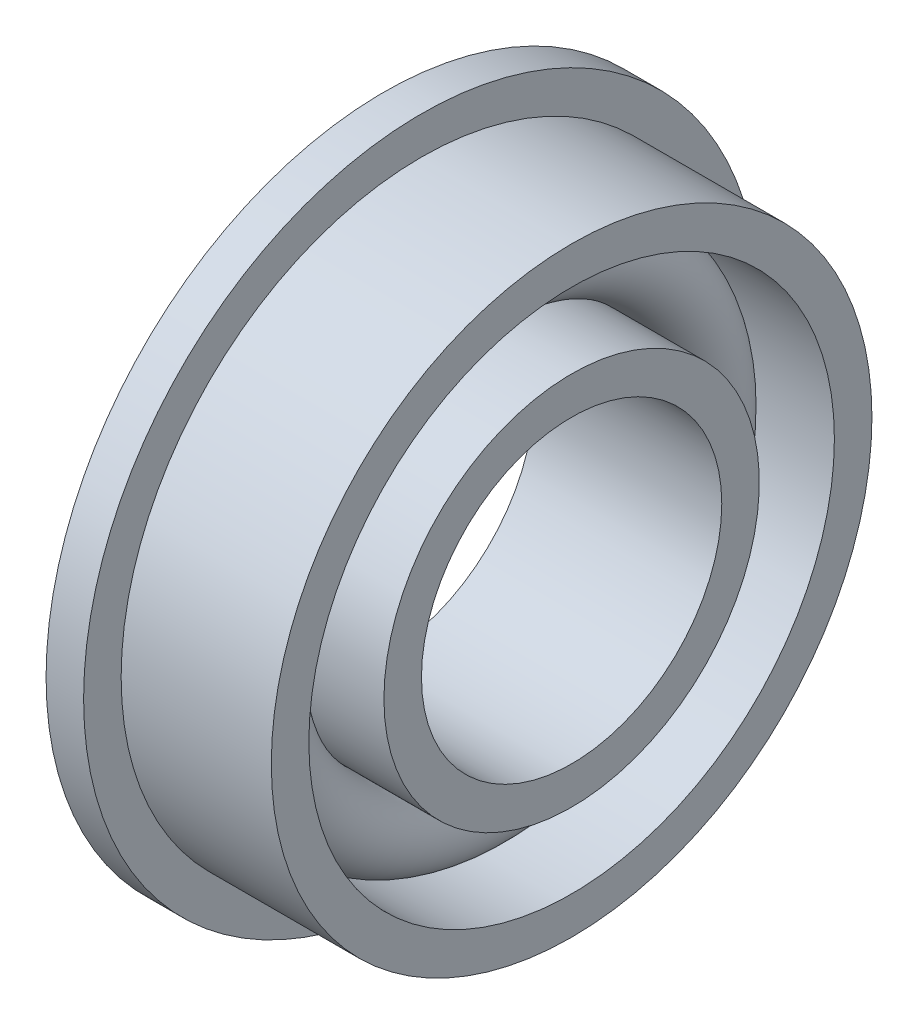
from build123d import *

# Parameters (mm, degrees)
SKETCH1_R = 1
SKETCH1_W = 5
SKETCH1_H = 1


with BuildPart() as part:
    # Sketch1 → Revolve1 (revolve)
    with BuildSketch(Plane.XY, mode=Mode.PRIVATE) as revolve1_sk:
        Polygon((5, 8), (5, 7), (0, 7), (0, 9), (1, 9), (1, 8), align=None)
        with Locations((2.5, 6)):
            Circle(SKETCH1_R)
        with Locations((2.5, 4.5)):
            Rectangle(SKETCH1_W, SKETCH1_H)
    revolve(revolve1_sk.sketch.rotate(Axis((0, 0, 0), (1, 0, 0)), 90), axis=Axis((0, 0, 0), (1, 0, 0)))


solid = part.part
